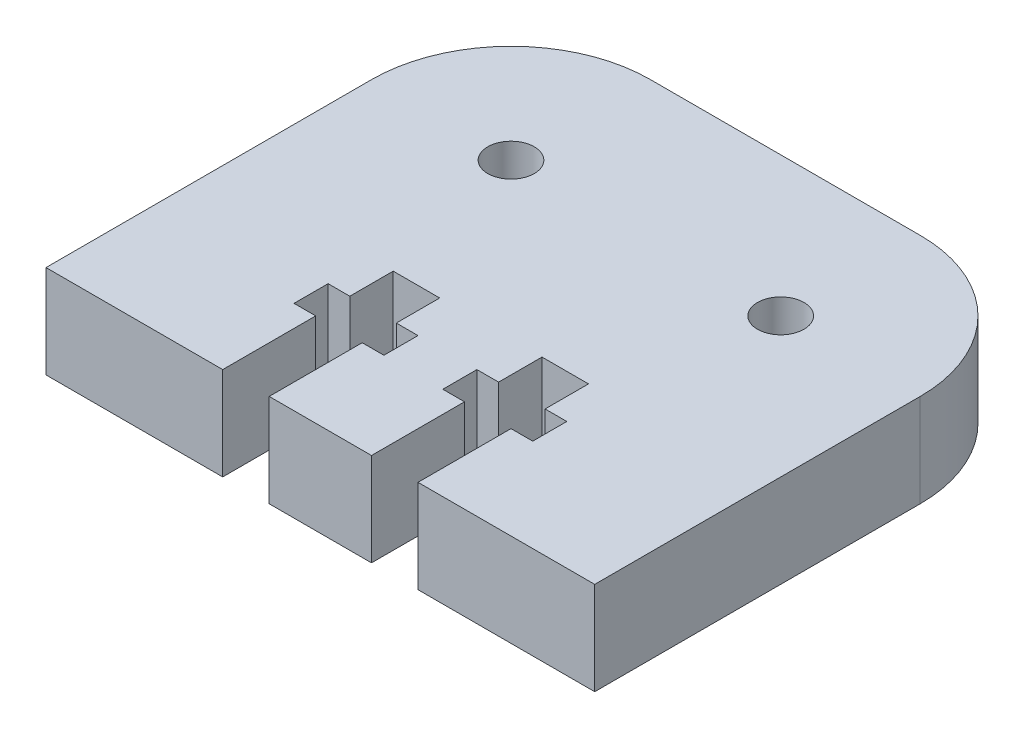
from build123d import *

# Parameters (mm, degrees)
SKETCH1_R           = 1.5
BOSS_EXTRUDE1_DEPTH = 6
FILLET1_R           = 9


with BuildPart() as part:
    # Sketch1 → Boss-Extrude1 (new body)
    with BuildSketch(Plane(origin=(0, 0, 0), x_dir=(1, 0, 0), z_dir=(0, 1, 0))):
        Polygon((-17.7, 15), (0, 15), (0, -15), (-3.3, -15), (-3.3, -9), (-1.9, -9), (-1.9, -6.8), (-3.3, -6.8), (-3.3, -4), (-6.3, -4), (-6.3, -6.8), (-7.7, -6.8), (-7.7, -9), (-6.3, -9), (-6.3, -15), (-17.7, -15), align=None)
        with Locations((-8.7, 6)):
            Circle(SKETCH1_R, mode=Mode.SUBTRACT)
    extrude(amount=BOSS_EXTRUDE1_DEPTH)

    # Mirror1: part across plane


with BuildPart() as part_1:
    add(part.part)
    add(part.part.mirror(Plane(origin=(0, 6, -15), x_dir=(0, 0, 1), z_dir=(-1, 0, 0))))

    # Fillet1
    fillet1_edges = [part_1.edges().sort_by_distance(p)[0] for p in [
        (17.7, 3, -15),
        (-17.7, 3, -15),
    ]]
    fillet(fillet1_edges, radius=FILLET1_R)


solid = part_1.part
